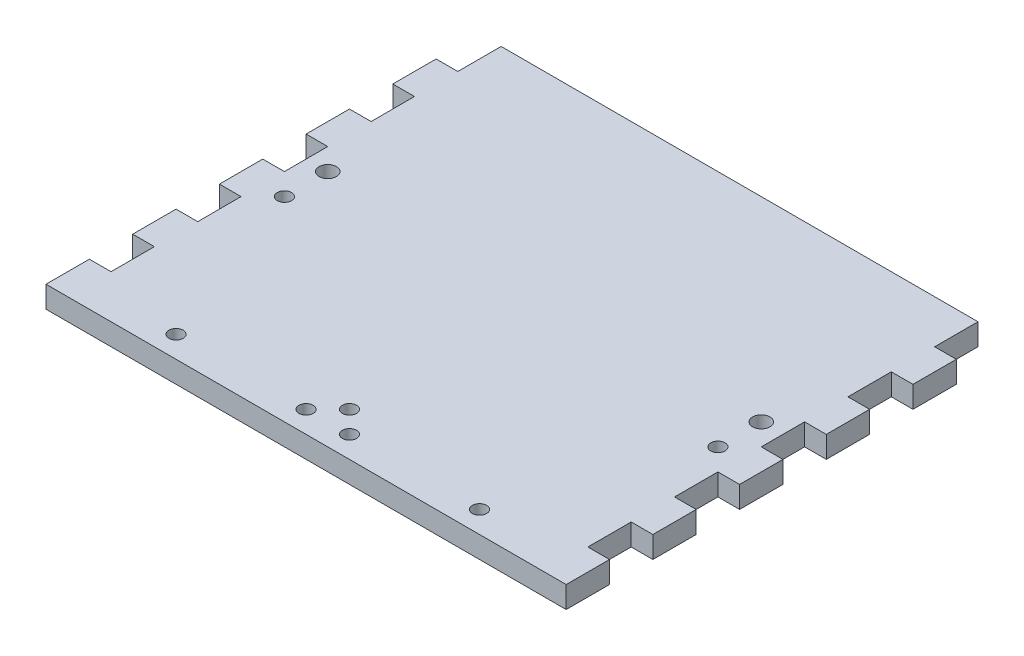
from build123d import *

# Parameters (mm, degrees)
SKETCH2_R           = 2.0828
SKETCH2_R_2         = 2.54
BOSS_EXTRUDE1_DEPTH = 6.35


with BuildPart() as part:
    # Sketch2 → Boss-Extrude1 (new body)
    with BuildSketch(Plane(origin=(0, 0, 0), x_dir=(1, 0, 0), z_dir=(0, 1, 0))):
        Polygon((3.175, 13.229166667), (3.175, 25.929166667), (-3.175, 25.929166667), (-3.175, 38.629166667), (3.175, 38.629166667), (3.175, 51.329166667), (-3.175, 51.329166667), (-3.175, 64.029166667), (3.175, 64.029166667), (3.175, 76.729166667), (-3.175, 76.729166667), (-3.175, 89.429166667), (3.175, 89.429166667), (3.175, 102.129166667), (-3.175, 102.129166667), (-3.175, 114.829166667), (3.175, 114.829166667), (3.175, 127.529166667), (142.875, 127.529166667), (142.875, 114.829166667), (149.225, 114.829166667), (149.225, 102.129166667), (142.875, 102.129166667), (142.875, 89.429166667), (149.225, 89.429166667), (149.225, 76.729166667), (142.875, 76.729166667), (142.875, 64.029166667), (149.225, 64.029166667), (149.225, 51.329166667), (142.875, 51.329166667), (142.875, 38.629166667), (149.225, 38.629166667), (149.225, 25.929166667), (142.875, 25.929166667), (142.875, 13.229166667), (149.225, 13.229166667), (149.225, 0.529166667), (-3.175, 0.529166667), (-3.175, 13.229166667), align=None)
        with Locations(Location((136.525, 57.679166667, 0), (0, 0, 90))):
            Circle(SKETCH2_R, mode=Mode.SUBTRACT)
        with Locations(Location((28.575, 6.879166667, 0), (0, 0, 270))):
            Circle(SKETCH2_R, mode=Mode.SUBTRACT)
        with Locations(Location((9.525, 57.679166667, 0), (0, 0, 270))):
            Circle(SKETCH2_R, mode=Mode.SUBTRACT)
        with Locations(Location((117.475, 6.879166667, 0), (0, 0, 90))):
            Circle(SKETCH2_R, mode=Mode.SUBTRACT)
        with Locations(Location((79.375, 6.879166667, 0), (0, 0, 270))):
            Circle(SKETCH2_R, mode=Mode.SUBTRACT)
        with Locations(Location((73.025, 13.229166667, 0), (0, 0, 270))):
            Circle(SKETCH2_R, mode=Mode.SUBTRACT)
        with Locations(Location((66.675, 6.879166667, 0), (0, 0, 270))):
            Circle(SKETCH2_R, mode=Mode.SUBTRACT)
        with Locations(Location((9.525, 70.379166667, 0), (0, 0, 270))):
            Circle(SKETCH2_R_2, mode=Mode.SUBTRACT)
        with Locations(Location((136.525, 70.379166667, 0), (0, 0, 90))):
            Circle(SKETCH2_R_2, mode=Mode.SUBTRACT)
    extrude(amount=BOSS_EXTRUDE1_DEPTH)


solid = part.part
